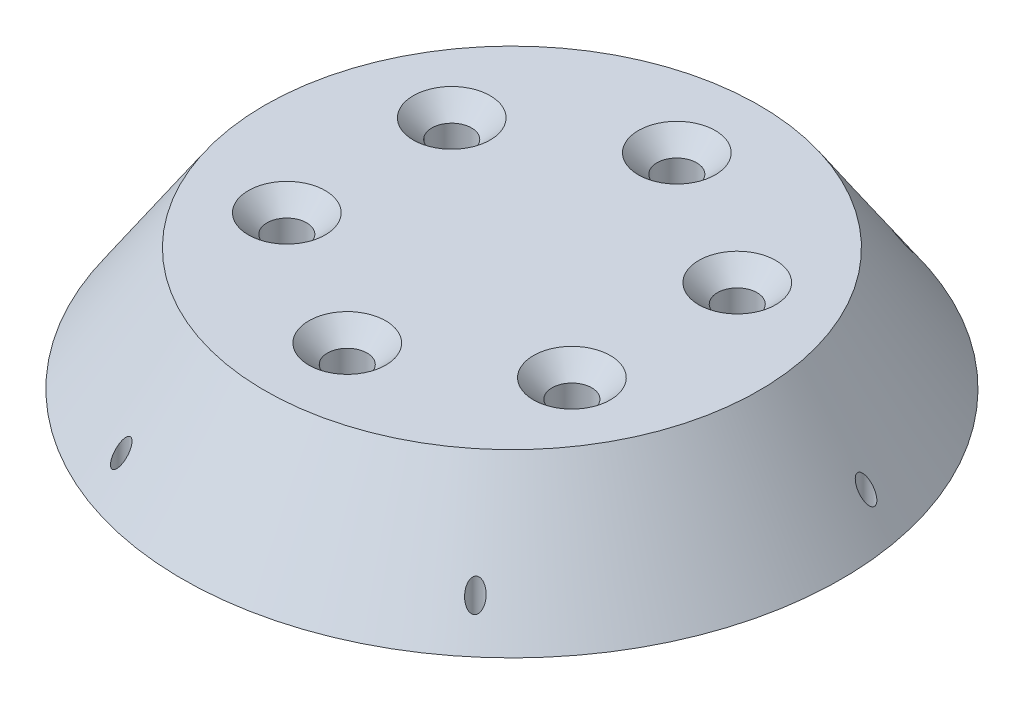
from build123d import *

# Parameters (mm, degrees)
CSK_FOR_ST6_3_CROSS_RECESSED_CTSK_HEAD_T_D           = 6.5
CSK_FOR_ST6_3_CROSS_RECESSED_CTSK_HEAD_T_CSINK_D     = 12.6
CSK_FOR_ST6_3_CROSS_RECESSED_CTSK_HEAD_T_CSINK_ANGLE = 90
CSK_FOR_ST6_3_CROSS_RECESSED_CTSK_HE_2_D             = 6.5
CSK_FOR_ST6_3_CROSS_RECESSED_CTSK_HE_2_CSINK_D       = 12.6
CSK_FOR_ST6_3_CROSS_RECESSED_CTSK_HE_2_CSINK_ANGLE   = 90
SKETCH9_R                                            = 1.25
CUT_EXTRUDE1_DEPTH                                   = 50
SKETCH9_3_R                                          = 1.25
CUT_EXTRUDE2_DEPTH                                   = 50
SKETCH9_4_R                                          = 1.25
CUT_EXTRUDE3_DEPTH                                   = 50
SKETCH9_5_R                                          = 1.25
CUT_EXTRUDE4_DEPTH                                   = 50
SKETCH9_7_R                                          = 1.25
CUT_EXTRUDE5_DEPTH                                   = 50
SKETCH9_8_R                                          = 1.25
CUT_EXTRUDE6_DEPTH                                   = 50


with BuildPart() as part:
    # Sketch1 → Revolve1 (revolve)
    with BuildSketch(Plane.XY):
        Polygon((0, 0), (40.5, 0), (40.5, -20), (-13.5, -20), align=None)
    revolve(axis=Axis((40.5, 11.538552748, 0), (0, -1, 0)))

    # CSK for ST6.3 Cross recessed CTSK head t (through all)
    with Locations(Plane(origin=(0, 0, 0), x_dir=(1, 0, 0), z_dir=(0, 1, 0))):
        with Locations((17.07072808, -13.455101055), (63.836068925, -13.508911829), (40.5, 27.017966747)):
            CounterSinkHole(CSK_FOR_ST6_3_CROSS_RECESSED_CTSK_HEAD_T_D / 2, CSK_FOR_ST6_3_CROSS_RECESSED_CTSK_HEAD_T_CSINK_D / 2, counter_sink_angle=CSK_FOR_ST6_3_CROSS_RECESSED_CTSK_HEAD_T_CSINK_ANGLE)

    # CSK for ST6.3 Cross recessed CTSK he 2 (through all)
    with Locations(Plane(origin=(0, 0, 0), x_dir=(1, 0, 0), z_dir=(0, 1, 0))):
        with Locations((17.117314098, 13.517966747), (63.882685902, 13.535897721), (40.5, -26.982033253)):
            CounterSinkHole(CSK_FOR_ST6_3_CROSS_RECESSED_CTSK_HE_2_D / 2, CSK_FOR_ST6_3_CROSS_RECESSED_CTSK_HE_2_CSINK_D / 2, counter_sink_angle=CSK_FOR_ST6_3_CROSS_RECESSED_CTSK_HE_2_CSINK_ANGLE)

    # Sketch9 → Cut-Extrude1 (cut)
    with BuildSketch(Plane.XZ.offset(20)):
        with Locations((89.719555543, -8.799735913)):
            Circle(SKETCH9_R)
    extrude(amount=-CUT_EXTRUDE1_DEPTH, mode=Mode.SUBTRACT)

    # Sketch9<3> → Cut-Extrude2 (cut)
    with BuildSketch(Plane.XZ.offset(20)):
        with Locations((72.730572619, 38.225517507)):
            Circle(SKETCH9_3_R)
    extrude(amount=-CUT_EXTRUDE2_DEPTH, mode=Mode.SUBTRACT)

    # Sketch9<4> → Cut-Extrude3 (cut)
    with BuildSketch(Plane.XZ.offset(20)):
        with Locations((23.511017076, 47.02525342)):
            Circle(SKETCH9_4_R)
    extrude(amount=-CUT_EXTRUDE3_DEPTH, mode=Mode.SUBTRACT)

    # Sketch9<5> → Cut-Extrude4 (cut)
    with BuildSketch(Plane.XZ.offset(20)):
        with Locations((-8.719555543, 8.799735913)):
            Circle(SKETCH9_5_R)
    extrude(amount=-CUT_EXTRUDE4_DEPTH, mode=Mode.SUBTRACT)

    # Sketch9<7> → Cut-Extrude5 (cut)
    with BuildSketch(Plane.XZ.offset(20)):
        with Locations((8.269427381, -38.225517507)):
            Circle(SKETCH9_7_R)
    extrude(amount=-CUT_EXTRUDE5_DEPTH, mode=Mode.SUBTRACT)

    # Sketch9<8> → Cut-Extrude6 (cut)
    with BuildSketch(Plane.XZ.offset(20)):
        with Locations((57.488982924, -47.02525342)):
            Circle(SKETCH9_8_R)
    extrude(amount=-CUT_EXTRUDE6_DEPTH, mode=Mode.SUBTRACT)


solid = part.part
